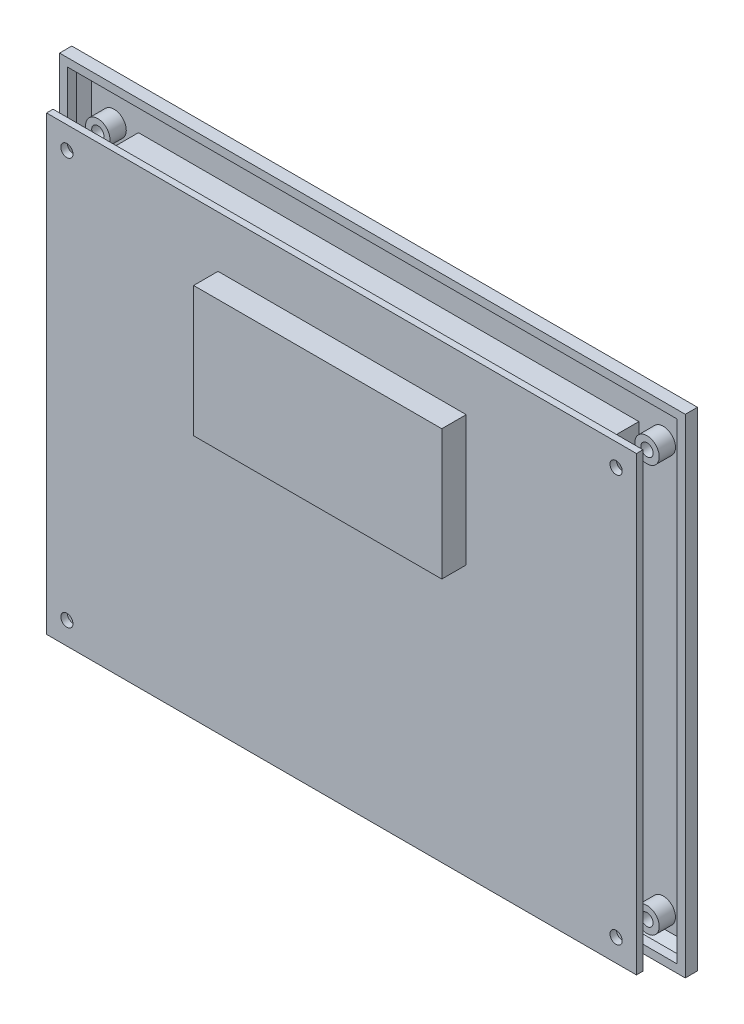
from build123d import *

# Parameters (mm, degrees)
SKETCH_1_W          = 153.8
SKETCH_1_H          = 120
SKETCH_1_W_2        = 113.5
SKETCH_1_H_2        = 85.5
EXTRUDE_1_DEPTH     = 6
CHAMFER_1_SIZE      = 3
SHELL_1_T           = -2
SKETCH_3_W          = 121.15685425
SKETCH_3_H          = 93.15685425
CUT_EXTRUDE_1_DEPTH = 4
SKETCH_4_R          = 3
SKETCH_4_R_2        = 1.5
EXTRUDE_3_DEPTH     = 4
SKETCH_2_W          = 123
SKETCH_2_H          = 102
EXTRUDE_2_DEPTH     = 10
SKETCH_5_W          = 145
SKETCH_5_H          = 111
EXTRUDE_4_DEPTH     = 1.6
CUT_EXTRUDE_START   = -1.6
SKETCH_6_R          = 1.5
CUT_EXTRUDE_2_DEPTH = 1.6
SKETCH_7_W          = 61
SKETCH_7_H          = 32
EXTRUDE_5_DEPTH     = 6


with BuildPart() as part:
    # 草图1 → 凸台-拉伸1 (new body)
    with BuildSketch(Plane.XY):
        Rectangle(SKETCH_1_W, SKETCH_1_H)
        with Locations((0, -2.25)):
            Rectangle(SKETCH_1_W_2, SKETCH_1_H_2, mode=Mode.SUBTRACT)
    extrude(amount=EXTRUDE_1_DEPTH)

    # 倒角1
    chamfer_1_edges = [part.edges().sort_by_distance(p)[0] for p in [
        (56.75, -2.25, 0),
        (0, 40.5, 0),
        (-56.75, -2.25, 0),
        (0, -45, 0),
        (0, 60, 0),
        (76.9, 0, 0),
        (0, -60, 0),
        (-76.9, 0, 0),
    ]]
    chamfer(chamfer_1_edges, length=CHAMFER_1_SIZE)

    # 抽壳1
    shell_1_openings = [part.faces().sort_by_distance(p)[0] for p in [
        (0, 58.049245274, 6),
    ]]
    offset(amount=SHELL_1_T, openings=shell_1_openings, kind=Kind.INTERSECTION)

    # 草图3 → 切除-拉伸1 (cut)
    with BuildSketch(Plane.XY.offset(6)):
        with Locations((0, -2.25)):
            Rectangle(SKETCH_3_W, SKETCH_3_H)
    extrude(amount=-CUT_EXTRUDE_1_DEPTH, mode=Mode.SUBTRACT)

    # 草图4 → 凸台-拉伸3 (add)
    # profile 1 of 4: a face of its own
    with BuildSketch(Plane.XY.offset(2)):
        with Locations((-67.5, 47.75)):
            Circle(SKETCH_4_R)
        with Locations((-67.5, 47.75)):
            Circle(SKETCH_4_R_2, mode=Mode.SUBTRACT)
    # profile 2 of 4: a face of its own
    with BuildSketch(Plane.XY.offset(2)):
        with Locations(Location((67.5, 47.75, 0), (0, 0, 180))):
            Circle(SKETCH_4_R)
        with Locations((67.5, 47.75)):
            Circle(SKETCH_4_R_2, mode=Mode.SUBTRACT)
    # profile 3 of 4: a face of its own
    with BuildSketch(Plane.XY.offset(2)):
        with Locations((67.5, -52.25)):
            Circle(SKETCH_4_R)
        with Locations((67.5, -52.25)):
            Circle(SKETCH_4_R_2, mode=Mode.SUBTRACT)
    # profile 4 of 4: a face of its own
    with BuildSketch(Plane.XY.offset(2)):
        with Locations(Location((-67.5, -52.25, 0), (0, 0, 180))):
            Circle(SKETCH_4_R)
        with Locations((-67.5, -52.25)):
            Circle(SKETCH_4_R_2, mode=Mode.SUBTRACT)
    extrude(amount=EXTRUDE_3_DEPTH)

    # 草图2 → 凸台-拉伸2 (add)
    with BuildSketch(Plane.XY.offset(2)):
        with Locations((0, -2.25)):
            Rectangle(SKETCH_2_W, SKETCH_2_H)
    extrude(amount=EXTRUDE_2_DEPTH)

    # 草图5 → 凸台-拉伸4 (add)
    with BuildSketch(Plane.XY.offset(12)):
        with Locations((0, -2.25)):
            Rectangle(SKETCH_5_W, SKETCH_5_H)
    extrude(amount=EXTRUDE_4_DEPTH)

    # 草图6 → 切除-拉伸2 (cut)
    with BuildSketch(Plane.XY.offset(13.6).offset(CUT_EXTRUDE_START)):
        with Locations((-67.5, 47.75)):
            Circle(SKETCH_6_R)
        with Locations((67.5, 47.75)):
            Circle(SKETCH_6_R)
        with Locations((67.5, -52.25)):
            Circle(SKETCH_6_R)
        with Locations((-67.5, -52.25)):
            Circle(SKETCH_6_R)
    extrude(amount=CUT_EXTRUDE_2_DEPTH, mode=Mode.SUBTRACT)

    # 草图7 → 凸台-拉伸5 (add)
    with BuildSketch(Plane.XY.offset(13.6)):
        with Locations((0.153519833, 24.604445294)):
            Rectangle(SKETCH_7_W, SKETCH_7_H)
    extrude(amount=EXTRUDE_5_DEPTH)


solid = part.part
